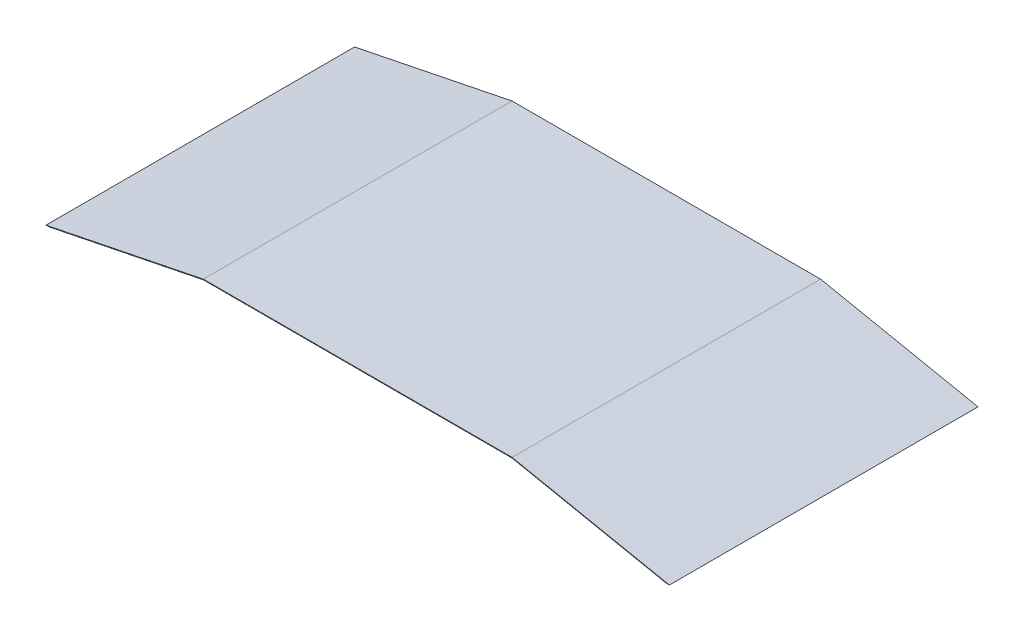
from build123d import *

# Parameters (mm, degrees)
EXTRUDE_1_DEPTH = 100


with BuildPart() as part:
    # 草图1 → 凸台-拉伸1 (new body)
    with BuildSketch(Plane.XY):
        Polygon((-100, 0), (-50, 10.135501775), (50, 10.135501775), (100, 0), (101, 0), (50, 10.338211811), (-50, 10.338211811), (-101, 0), align=None)
    extrude(amount=EXTRUDE_1_DEPTH)


solid = part.part
